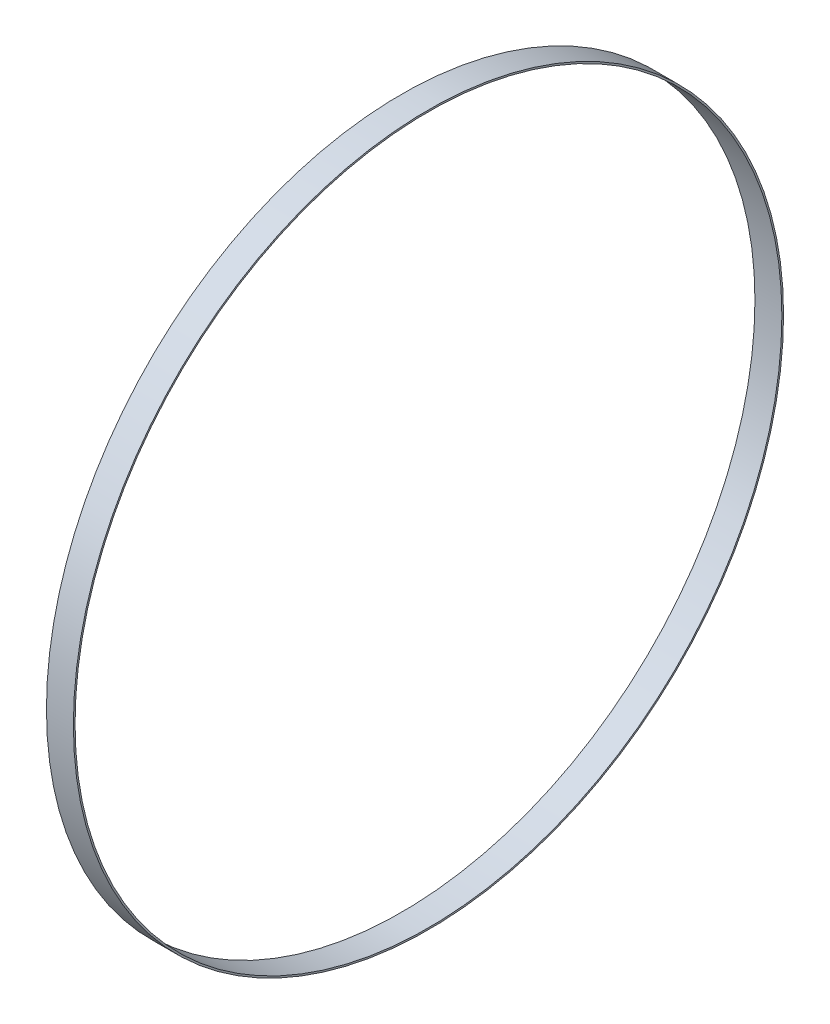
from build123d import *

# Parameters (mm, degrees)
SKETCH1_R           = 1055
SKETCH1_R_2         = 1050
BOSS_EXTRUDE1_DEPTH = 80


with BuildPart() as part:
    # Sketch1 → Boss-Extrude1 (new body)
    with BuildSketch(Plane(origin=(0, 0, 0), x_dir=(0, 0, -1), z_dir=(1, 0, 0))):
        Circle(SKETCH1_R)
        Circle(SKETCH1_R_2, mode=Mode.SUBTRACT)
    extrude(amount=BOSS_EXTRUDE1_DEPTH)


solid = part.part
